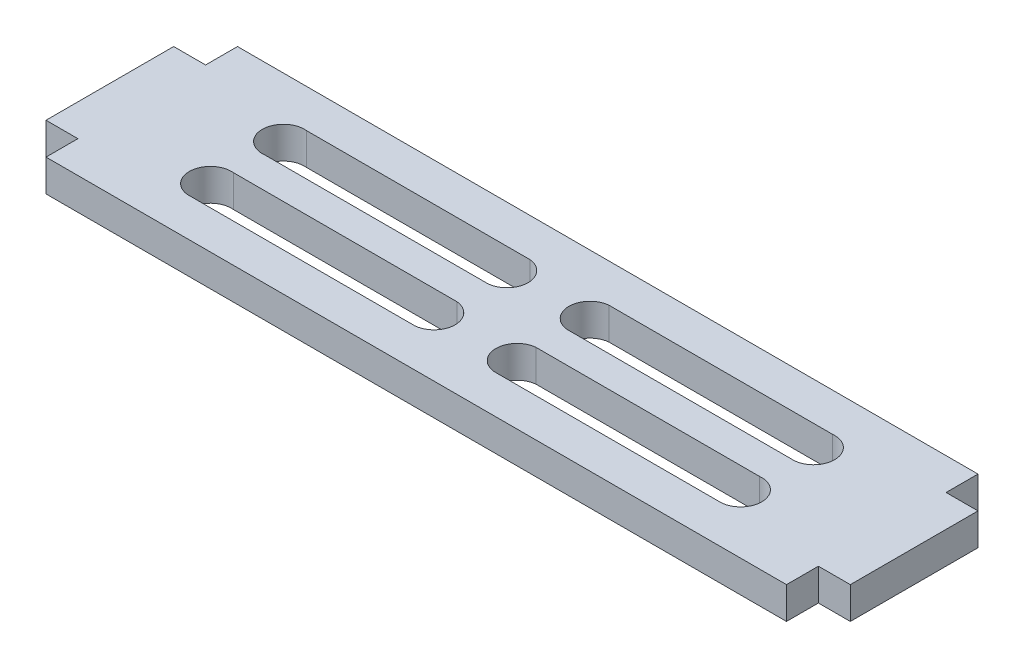
from build123d import *

# Parameters (mm, degrees)
BOSS_EXTRUDE1_DEPTH = 5


with BuildPart() as part:
    # Sketch2 → Boss-Extrude1 (new body)
    with BuildSketch(Plane(origin=(0, 0, 0), x_dir=(1, 0, 0), z_dir=(0, 1, 0))):
        Polygon((46.589298205, 13.308977097), (51.589298205, 13.308977097), (95.089298205, 13.308977097), (95.089298205, 8.308977097), (100.089298205, 8.308977097), (100.089298205, -11.691022903), (95.089298205, -11.691022903), (95.089298205, -16.691022903), (-20.910701795, -16.691022903), (-20.910701795, -11.691022903), (-25.910701795, -11.691022903), (-25.910701795, 8.308977097), (-20.910701795, 8.308977097), (-20.910701795, 13.308977097), (22.589298205, 13.308977097), (27.589298205, 13.308977097), align=None)
        with BuildLine():
            Line((78.271526231, -10.691022903), (43.271526231, -10.691022903))
            ThreePointArc((43.271526231, -10.691022903), (40.290117596, -7.406437763), (43.271526231, -4.121852623))
            Line((43.271526231, -4.121852623), (78.271526231, -4.121852623))
            ThreePointArc((78.271526231, -4.121852623), (81.920004192, -7.406437763), (78.271526231, -10.691022903))
        make_face(mode=Mode.SUBTRACT)
        with BuildLine():
            Line((-4.092929821, -4.121852623), (30.907070179, -4.121852623))
            ThreePointArc((30.907070179, -4.121852623), (33.888478814, -7.406437763), (30.907070179, -10.691022903))
            Line((30.907070179, -10.691022903), (-4.092929821, -10.691022903))
            ThreePointArc((-4.092929821, -10.691022903), (-7.741407782, -7.406437763), (-4.092929821, -4.121852623))
        make_face(mode=Mode.SUBTRACT)
        with BuildLine():
            Line((-4.092929821, 7.308977097), (30.907070179, 7.308977097))
            ThreePointArc((30.907070179, 7.308977097), (33.888478814, 4.024391957), (30.907070179, 0.739806817))
            Line((30.907070179, 0.739806817), (-4.092929821, 0.739806817))
            ThreePointArc((-4.092929821, 0.739806817), (-7.741407782, 4.024391957), (-4.092929821, 7.308977097))
        make_face(mode=Mode.SUBTRACT)
        with BuildLine():
            Line((78.271526231, 0.739806817), (43.271526231, 0.739806817))
            ThreePointArc((43.271526231, 0.739806817), (40.290117596, 4.024391957), (43.271526231, 7.308977097))
            Line((43.271526231, 7.308977097), (78.271526231, 7.308977097))
            ThreePointArc((78.271526231, 7.308977097), (81.920004192, 4.024391957), (78.271526231, 0.739806817))
        make_face(mode=Mode.SUBTRACT)
    extrude(amount=BOSS_EXTRUDE1_DEPTH)


solid = part.part
